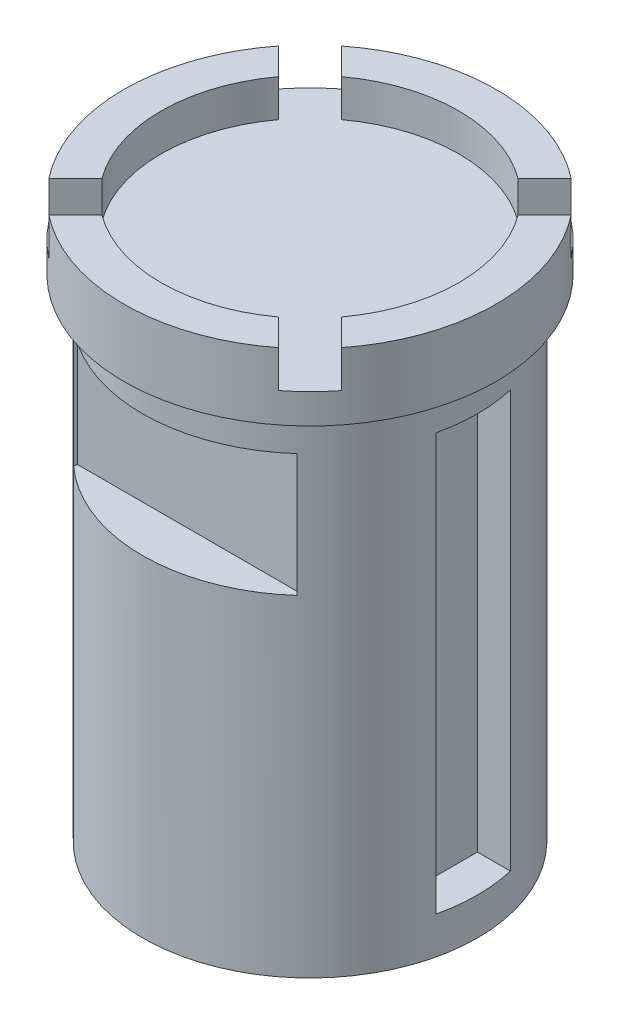
from build123d import *

# Parameters (mm, degrees)
SOLAR_DIVOT_SKETCH_W              = 100
SOLAR_DIVOT_SKETCH_H              = 200
SOLAR_DIVOT_CUT_DEPTH             = 1120
MISC_BAY_SKETCH_W                 = 600
MISC_BAY_SKETCH_H                 = 124.589803375
MISC_BAY_CUT_DEPTH                = 330
LAUNCH_ADAPTOR_BAY_SKETCH_R       = 370
LAUNCH_ADAPTOR_BAY_CUT_DEPTH      = 40
GRIPPER_GAP_CUT_DEPTH             = 100
GRIPPER_GAP_CUT_PROPAGATION_COUNT = 4


with BuildPart() as part:
    # Body Block Sketch → Body Block Revolve (revolve)
    with BuildSketch(Plane.XY, mode=Mode.PRIVATE) as body_block_revolve_sk:
        Polygon((0, 0), (400, 0), (400, 100), (500, 100), (500, 0), (500, -80), (450, -80), (450, -1400), (0, -1400), align=None)
    revolve(body_block_revolve_sk.sketch.rotate(Axis((0, 0, 0), (0, -1, 0)), 180), axis=Axis((0, 0, 0), (0, -1, 0)))

    # Solar Divot Sketch → Solar Divot Cut (cut)
    with BuildSketch(Plane(origin=(0, -180, 0), x_dir=(-1, 0, 0), z_dir=(0, -1, 0))):
        with Locations((-400, 0)):
            Rectangle(SOLAR_DIVOT_SKETCH_W, SOLAR_DIVOT_SKETCH_H)
        with Locations((400, 0)):
            Rectangle(SOLAR_DIVOT_SKETCH_W, SOLAR_DIVOT_SKETCH_H)
    extrude(amount=SOLAR_DIVOT_CUT_DEPTH, mode=Mode.SUBTRACT)

    # Misc Bay Sketch → Misc Bay Cut (cut)
    with BuildSketch(Plane(origin=(0, -180, 0), x_dir=(-1, 0, 0), z_dir=(0, -1, 0))):
        with Locations((0, 387.705098313)):
            Rectangle(MISC_BAY_SKETCH_W, MISC_BAY_SKETCH_H)
        with Locations((0, -387.705098313)):
            Rectangle(MISC_BAY_SKETCH_W, MISC_BAY_SKETCH_H)
    extrude(amount=MISC_BAY_CUT_DEPTH, mode=Mode.SUBTRACT)

    # Launch Adaptor Bay Sketch → Launch Adaptor Bay Cut (cut)
    with BuildSketch(Plane.XZ.offset(1400)):
        Circle(LAUNCH_ADAPTOR_BAY_SKETCH_R)
    extrude(amount=-LAUNCH_ADAPTOR_BAY_CUT_DEPTH, mode=Mode.SUBTRACT)

    # Gripper Gap Sketch → Gripper Gap Cut (cut)
    with BuildSketch(Plane(origin=(0, 0, 0), x_dir=(1, 0, 0), z_dir=(0, 1, 0))):
        Polygon((311.126983722, 395.979797464), (395.979797464, 311.126983722), (42.426406871, -42.426406871), (-42.426406871, 42.426406871), align=None)
    gripper_gap_cut = extrude(amount=GRIPPER_GAP_CUT_DEPTH, mode=Mode.SUBTRACT)

    # Gripper Gap Cut Propagation: Gripper Gap Cut ×4 about axis
    gripper_gap_cut_propagation_axis = Axis((0, 0, 0), (0, 1, 0))
    for i in range(1, GRIPPER_GAP_CUT_PROPAGATION_COUNT):
        add(gripper_gap_cut.rotate(gripper_gap_cut_propagation_axis, i * 360 / GRIPPER_GAP_CUT_PROPAGATION_COUNT), mode=Mode.SUBTRACT)


solid = part.part
